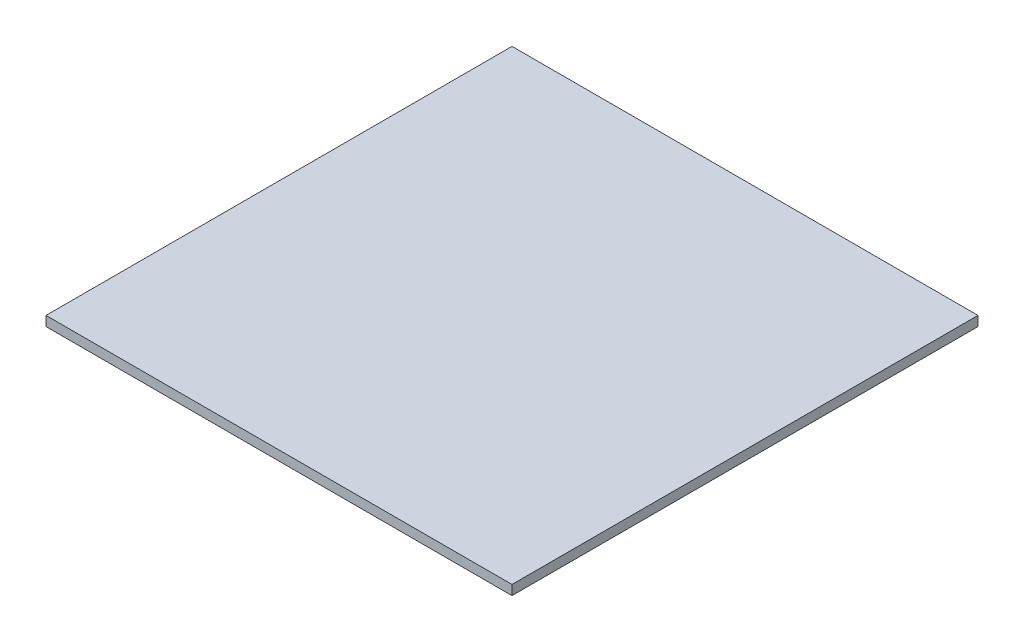
from build123d import *

# Parameters (mm, degrees)
SKETCH1_W           = 877.8875
SKETCH1_H           = 877.8875
BOSS_EXTRUDE1_DEPTH = 18.25625


with BuildPart() as part:
    # Sketch1 → Boss-Extrude1 (new body)
    with BuildSketch(Plane(origin=(0, 0, 0), x_dir=(1, 0, 0), z_dir=(0, 1, 0))):
        Rectangle(SKETCH1_W, SKETCH1_H)
    extrude(amount=BOSS_EXTRUDE1_DEPTH)


solid = part.part
